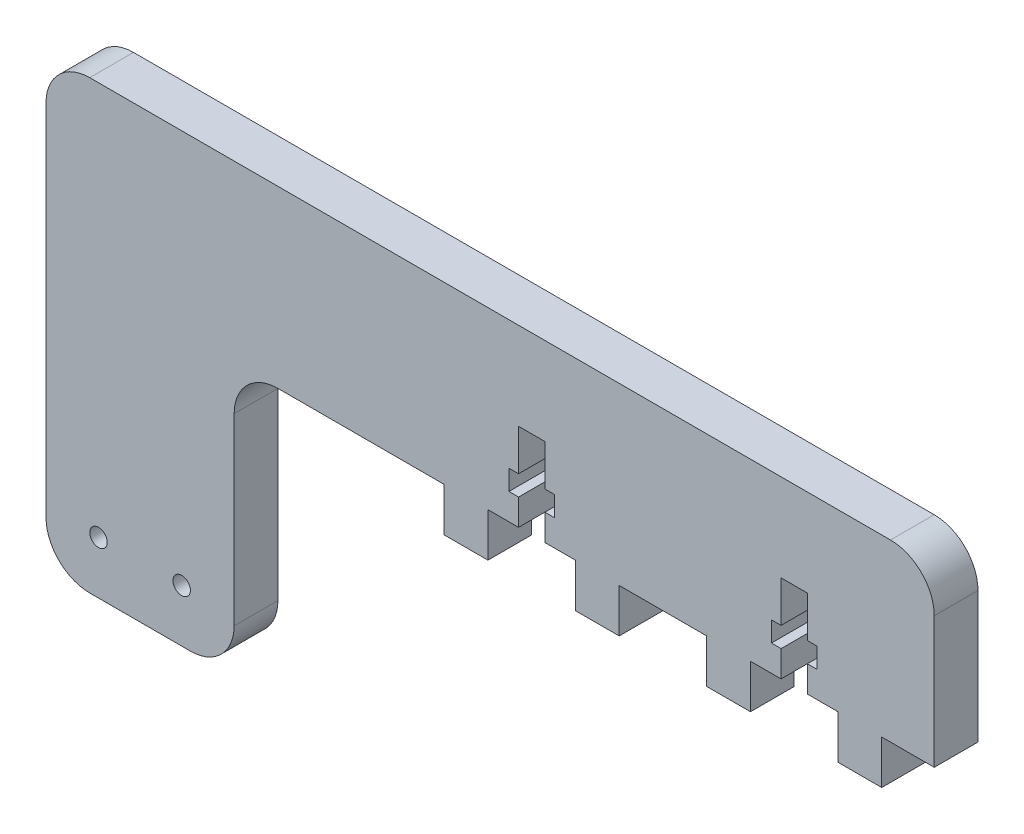
from build123d import *

# Parameters (mm, degrees)
ESQUISSE1_R        = 1
BOSS_EXTRU_1_DEPTH = 5
CONG_1_R           = 5


with BuildPart() as part:
    # Esquisse1 → Boss.-Extru.1 (new body)
    with BuildSketch(Plane.XY):
        Polygon((-16.5, 0), (-20, 0), (-20, -5), (-25, -5), (-25, 0), (-49, 0), (-49, -31), (-70.5, -31), (-70.5, 0), (-70.5, 20), (31.001104841, 20), (31.001104841, 0), (25, 0), (25, -5), (20, -5), (20, 0), (16.5, 0), (16.5, 3), (17.6, 3), (17.6, 5.3), (16.5, 5.3), (16.5, 10), (13.5, 10), (13.5, 5.3), (12.4, 5.3), (12.4, 3), (13.5, 3), (13.5, 0), (10, 0), (10, -5), (5, -5), (5, 0), (-5, 0), (-5, -5), (-10, -5), (-10, 0), (-13.5, 0), (-13.5, 3), (-12.4, 3), (-12.4, 5.3), (-13.5, 5.3), (-13.5, 10), (-16.5, 10), (-16.5, 5.3), (-17.6, 5.3), (-17.6, 3), (-16.5, 3), align=None)
        with Locations((-64.5, -25)):
            Circle(ESQUISSE1_R, mode=Mode.SUBTRACT)
        with Locations((-55, -25)):
            Circle(ESQUISSE1_R, mode=Mode.SUBTRACT)
    extrude(amount=BOSS_EXTRU_1_DEPTH)

    # Congé1
    cong_1_edges = [part.edges().sort_by_distance(p)[0] for p in [
        (-49, 0, 2.5),
        (-49, -31, 2.5),
        (-70.5, -31, 2.5),
        (-70.5, 20, 2.5),
        (31.001104841, 20, 2.5),
    ]]
    fillet(cong_1_edges, radius=CONG_1_R)


solid = part.part
